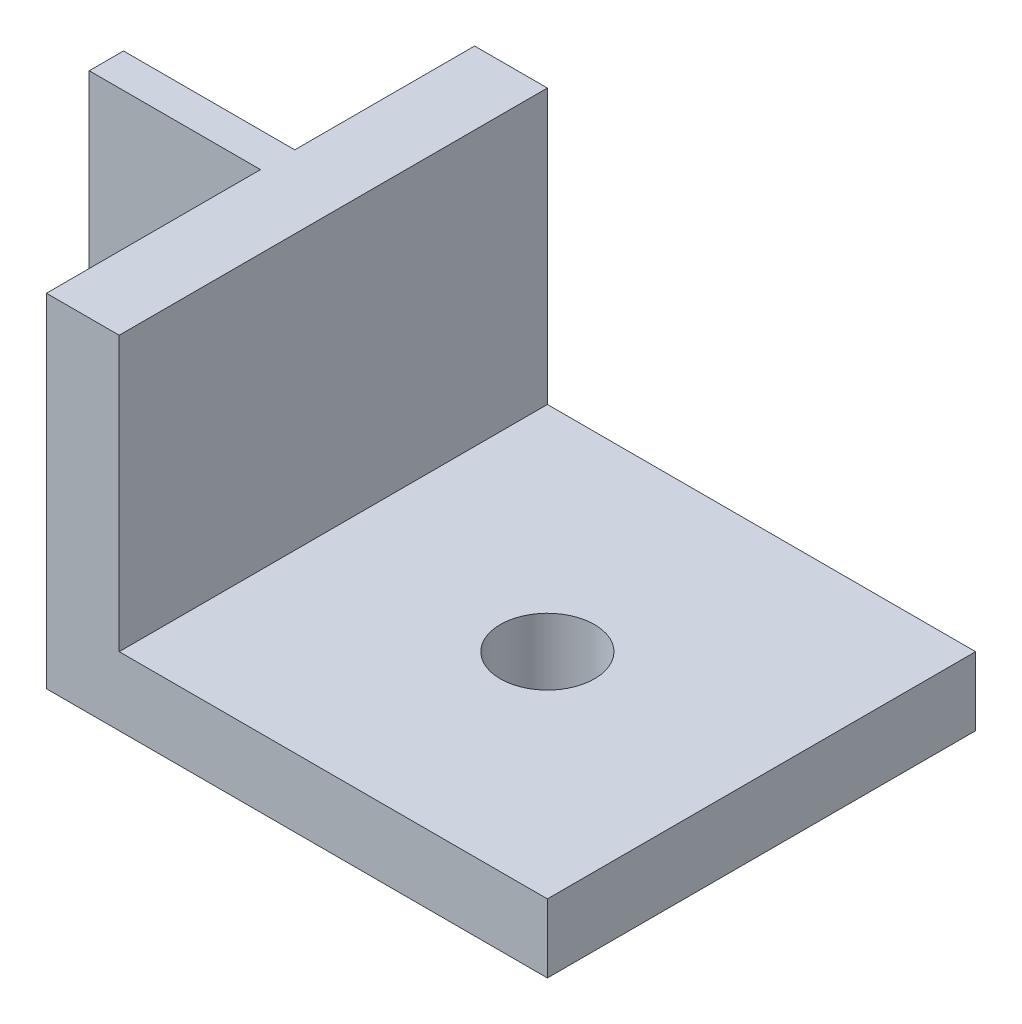
from build123d import *

# Parameters (mm, degrees)
SKETCH_1_W          = 25
SKETCH_1_H          = 25
SKETCH_1_R          = 2.75
EXTRUDE_1_DEPTH     = 4
SKETCH_1_3_W        = 15
SKETCH_1_3_H        = 25
EXTRUDE_2_DEPTH     = 20
SKETCH_2_W          = 10.750885586
SKETCH_2_H          = 25
CUT_EXTRUDE_1_DEPTH = 43
SKETCH_3_W          = 10
SKETCH_3_H          = 2
EXTRUDE_4_DEPTH     = 20


with BuildPart() as part:
    # 草图1 → 凸台-拉伸1 (new body)
    with BuildSketch(Plane(origin=(0, 0, 0), x_dir=(1, 0, 0), z_dir=(0, 1, 0))):
        Rectangle(SKETCH_1_W, SKETCH_1_H)
        with Locations(Location((0, 0, 0), (0, 0, 270))):
            Circle(SKETCH_1_R, mode=Mode.SUBTRACT)
    extrude(amount=EXTRUDE_1_DEPTH)

    # 草图1<3> → 凸台-拉伸2 (add)
    with BuildSketch(Plane(origin=(0, 0, 0), x_dir=(1, 0, 0), z_dir=(0, 1, 0))):
        with Locations((-20, 0)):
            Rectangle(SKETCH_1_3_W, SKETCH_1_3_H)
    extrude(amount=EXTRUDE_2_DEPTH)

    # 草图2 → 切除-拉伸1 (cut)
    with BuildSketch(Plane(origin=(0, 20, 0), x_dir=(1, 0, 0), z_dir=(0, 1, 0))):
        with Locations((-22.124557207, 0)):
            Rectangle(SKETCH_2_W, SKETCH_2_H)
    extrude(amount=-CUT_EXTRUDE_1_DEPTH, mode=Mode.SUBTRACT)

    # 草图3 → 凸台-拉伸4 (add)
    with BuildSketch(Plane(origin=(0, 20, 0), x_dir=(1, 0, 0), z_dir=(0, 1, 0))):
        with Locations((-21.749114414, 1)):
            Rectangle(SKETCH_3_W, SKETCH_3_H)
    extrude(amount=-EXTRUDE_4_DEPTH)


solid = part.part
